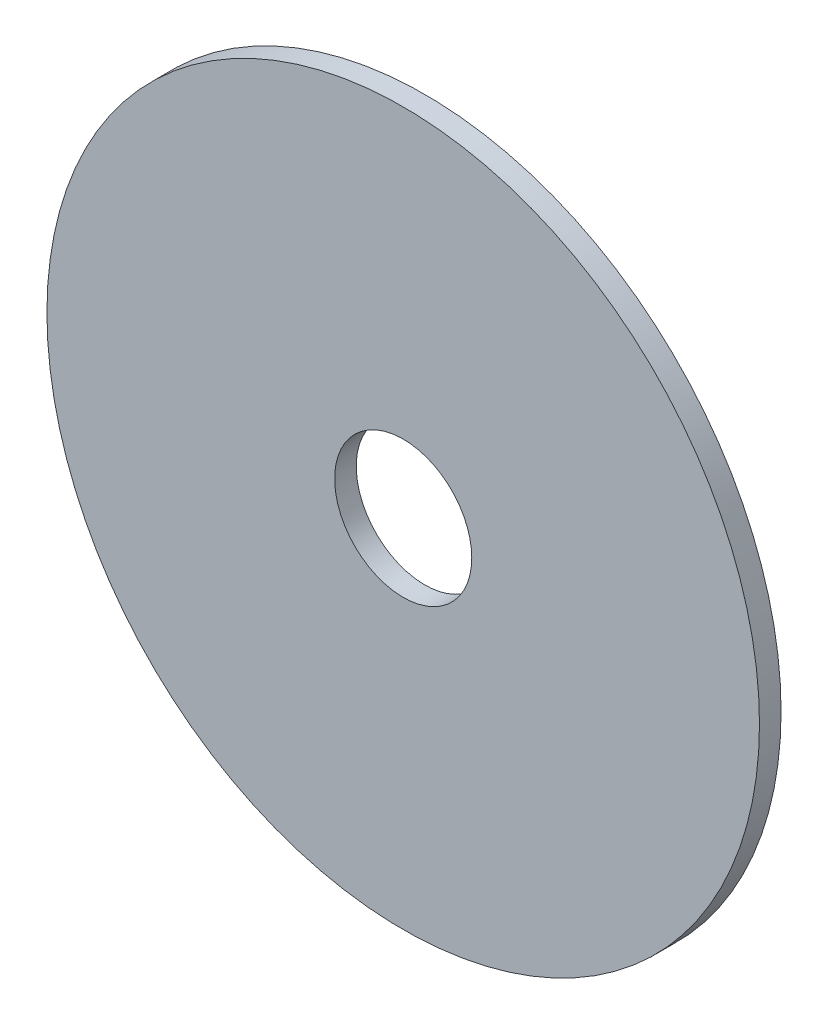
from build123d import *

# Parameters (mm, degrees)
SKETCH1_R           = 33
SKETCH1_R_2         = 6.349999905
BOSS_EXTRUDE1_DEPTH = 2


with BuildPart() as part:
    # Sketch1 → Boss-Extrude1 (new body)
    with BuildSketch(Plane.XY):
        Circle(SKETCH1_R)
        Circle(SKETCH1_R_2, mode=Mode.SUBTRACT)
    extrude(amount=BOSS_EXTRUDE1_DEPTH)


solid = part.part
